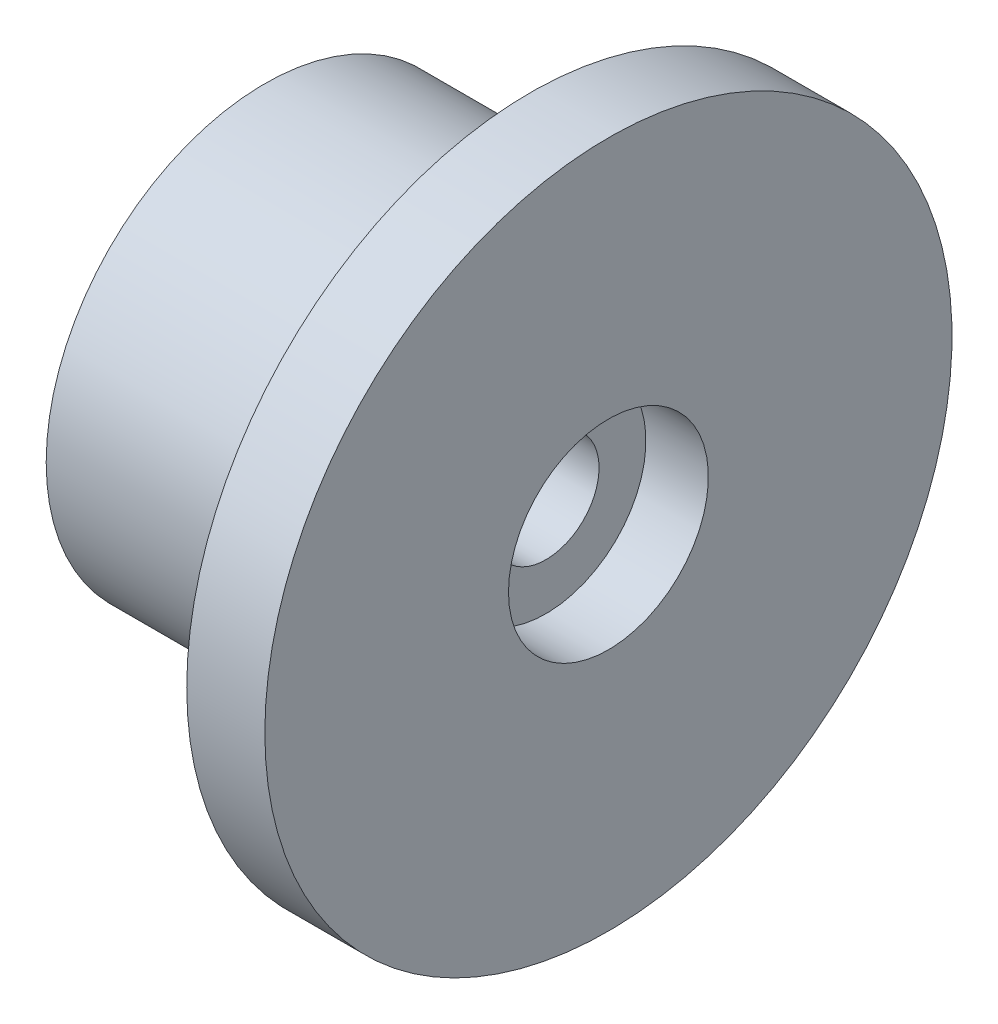
from build123d import *


with BuildPart() as part:
    # Sketch1 → Pin (revolve)
    with BuildSketch(Plane.XY, mode=Mode.PRIVATE) as pin_sk:
        Polygon((0, 1.7), (0, 7), (8.5, 7), (8.5, 11), (11, 11), (11, 3.2), (9, 3.2), (9, 1.7), align=None)
    revolve(pin_sk.sketch.rotate(Axis((-5, 0, 0), (1, 0, 0)), 90), axis=Axis((-5, 0, 0), (1, 0, 0)))


solid = part.part
